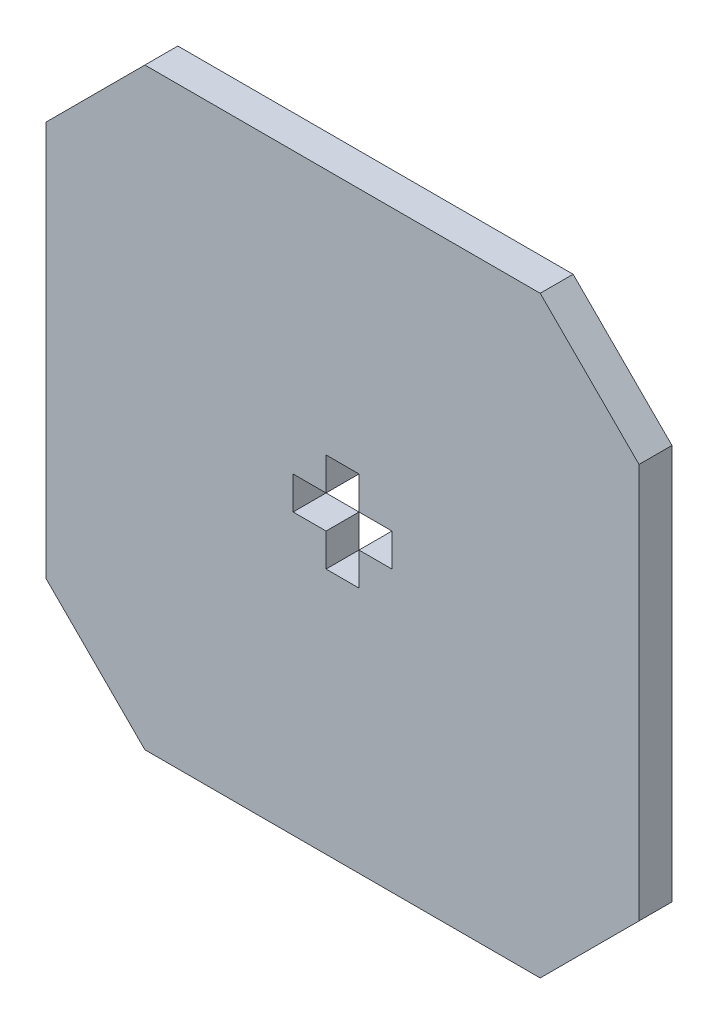
from build123d import *

# Parameters (mm, degrees)
BOSS_EXTRUDE1_DEPTH = 3


with BuildPart() as part:
    # Sketch1 → Boss-Extrude1 (new body)
    with BuildSketch(Plane.XY):
        Polygon((336.00000486, 251.99999521), (327.00000486, 242.99999521), (291.00000486, 242.99999521), (282.00000486, 251.99999521), (282.00000486, 287.99999521), (291.00000486, 296.99999521), (327.00000486, 296.99999521), (336.00000486, 287.99999521), align=None)
        Polygon((307.50000486, 274.49999521), (307.50000486, 271.49999521), (304.50000486, 271.49999521), (304.50000486, 268.49999521), (307.50000486, 268.49999521), (307.50000486, 265.49999521), (310.50000486, 265.49999521), (310.50000486, 268.49999521), (313.50000486, 268.49999521), (313.50000486, 271.49999521), (310.50000486, 271.49999521), (310.50000486, 274.49999521), align=None, mode=Mode.SUBTRACT)
    extrude(amount=BOSS_EXTRUDE1_DEPTH)


solid = part.part
